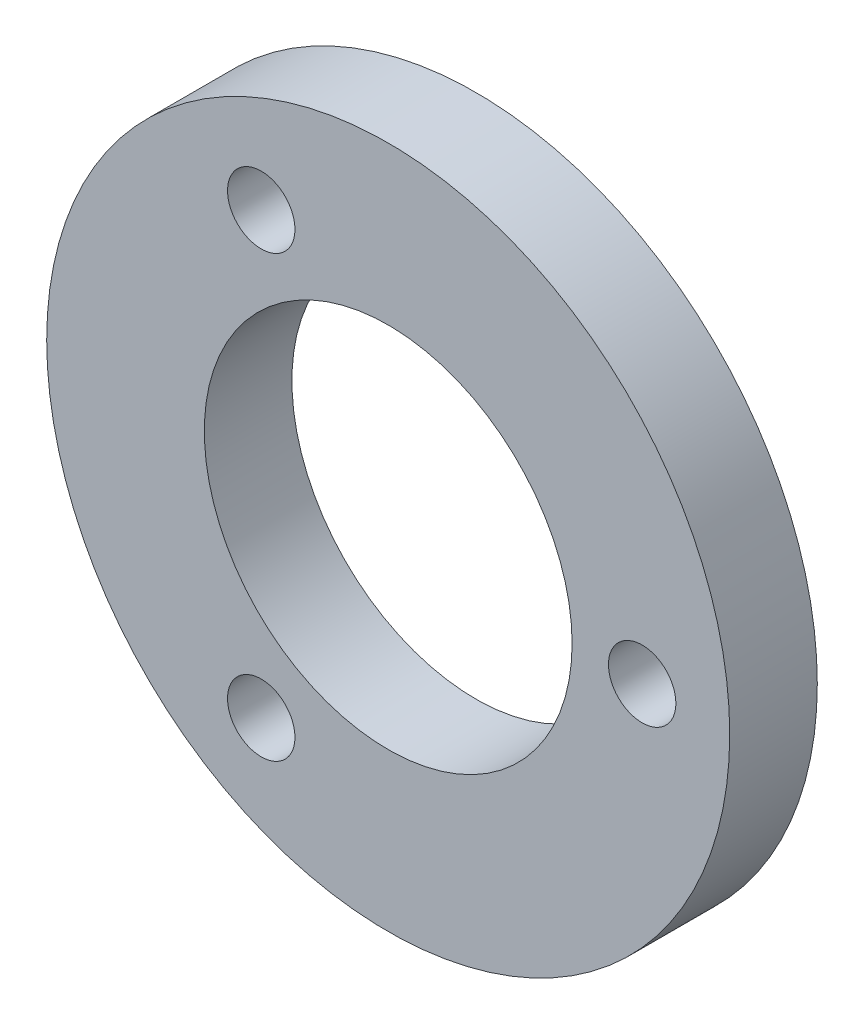
from build123d import *

# Parameters (mm, degrees)
ESQUISSE1_R        = 19.5
ESQUISSE1_R_2      = 10.5
ESQUISSE1_R_3      = 1.925
BOSS_EXTRU_1_DEPTH = 5


with BuildPart() as part:
    # Esquisse1 → Boss.-Extru.1 (new body)
    with BuildSketch(Plane.XY):
        Circle(ESQUISSE1_R)
        Circle(ESQUISSE1_R_2, mode=Mode.SUBTRACT)
        with Locations((-7.25, -12.557368355)):
            Circle(ESQUISSE1_R_3, mode=Mode.SUBTRACT)
        with Locations((14.5, 0)):
            Circle(ESQUISSE1_R_3, mode=Mode.SUBTRACT)
        with Locations((-7.25, 12.557368355)):
            Circle(ESQUISSE1_R_3, mode=Mode.SUBTRACT)
    extrude(amount=BOSS_EXTRU_1_DEPTH)


solid = part.part
